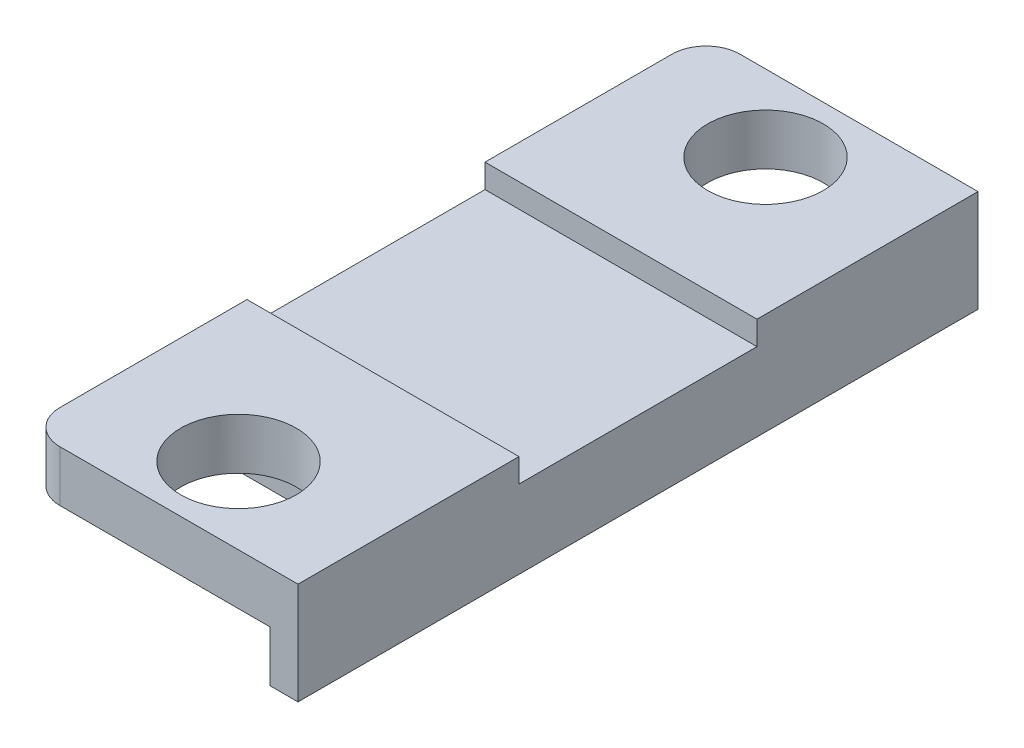
from build123d import *

# Parameters (mm, degrees)
CROQUIS1_W              = 8
CROQUIS1_H              = 20
CROQUIS1_R              = 1.7
SALIENTE_EXTRUIR1_DEPTH = 3
CORTAR_EXTRUIR2_DEPTH   = 1.5
CORTAR_EXTRUIR3_REACH   = 25.601
CROQUIS3_W              = 7
CROQUIS3_H              = 1
REDONDEO1_R             = 1
CROQUIS4_W              = 8
CROQUIS4_H              = 7
SALIENTE_EXTRUIR2_DEPTH = 0.3


with BuildPart() as part:
    # Croquis1 → Saliente-Extruir1 (new body)
    with BuildSketch(Plane(origin=(0, 0, 0), x_dir=(1, 0, 0), z_dir=(0, 1, 0))):
        with Locations((165.962302832, -11.999998776)):
            Rectangle(CROQUIS1_W, CROQUIS1_H)
        with Locations(Location((165.962302832, -4.249998776, 0), (0, 0, 270))):
            Circle(CROQUIS1_R, mode=Mode.SUBTRACT)
        with Locations(Location((165.962302832, -19.75, 0), (0, 0, 270))):
            Circle(CROQUIS1_R, mode=Mode.SUBTRACT)
    extrude(amount=-SALIENTE_EXTRUIR1_DEPTH)

    # Croquis2 → Cortar-Extruir2 (cut)
    with BuildSketch(Plane.XZ.offset(3)):
        Polygon((164.374589592, 17), (167.550016072, 17), (169.137729313, 19.75), (169.137729313, 21.999998776), (161.962302832, 21.999998776), (161.962302832, 17), align=None)
        Polygon((161.962302832, 6.999997552), (164.374589592, 6.999997552), (167.550016072, 6.999997552), (169.137729313, 4.249997552), (169.137729313, 1.999998776), (161.962302832, 1.999998776), align=None)
    extrude(amount=-CORTAR_EXTRUIR2_DEPTH, mode=Mode.SUBTRACT)

    # Croquis3 → Cortar-Extruir3 (cut, up to next)
    with BuildSketch(Plane.ZY.offset(-161.962302832), mode=Mode.PRIVATE) as cortar_extruir3_sk1:
        with Locations((11.999998776, -0.5)):
            Rectangle(CROQUIS3_W, CROQUIS3_H)
    cortar_extruir3_tool1 = extrude(cortar_extruir3_sk1.sketch, amount=-CORTAR_EXTRUIR3_REACH, mode=Mode.PRIVATE) & part.part
    add(cortar_extruir3_tool1.solids().sort_by_distance((161.962303, -0.5, 11.999999))[0], mode=Mode.SUBTRACT)

    # Redondeo1
    redondeo1_edges = [part.edges().sort_by_distance(p)[0] for p in [
        (161.962302832, -0.75, 21.999998776),
        (161.962302832, -3, 11.999998776),
        (161.962302832, -0.75, 1.999998776),
    ]]
    fillet(redondeo1_edges, radius=REDONDEO1_R)

    # Croquis4 → Saliente-Extruir2 (add)
    with BuildSketch(Plane(origin=(0, -1, 0), x_dir=(1, 0, 0), z_dir=(0, 1, 0))):
        with Locations((165.962302832, -11.999998776)):
            Rectangle(CROQUIS4_W, CROQUIS4_H)
    extrude(amount=SALIENTE_EXTRUIR2_DEPTH)


solid = part.part
